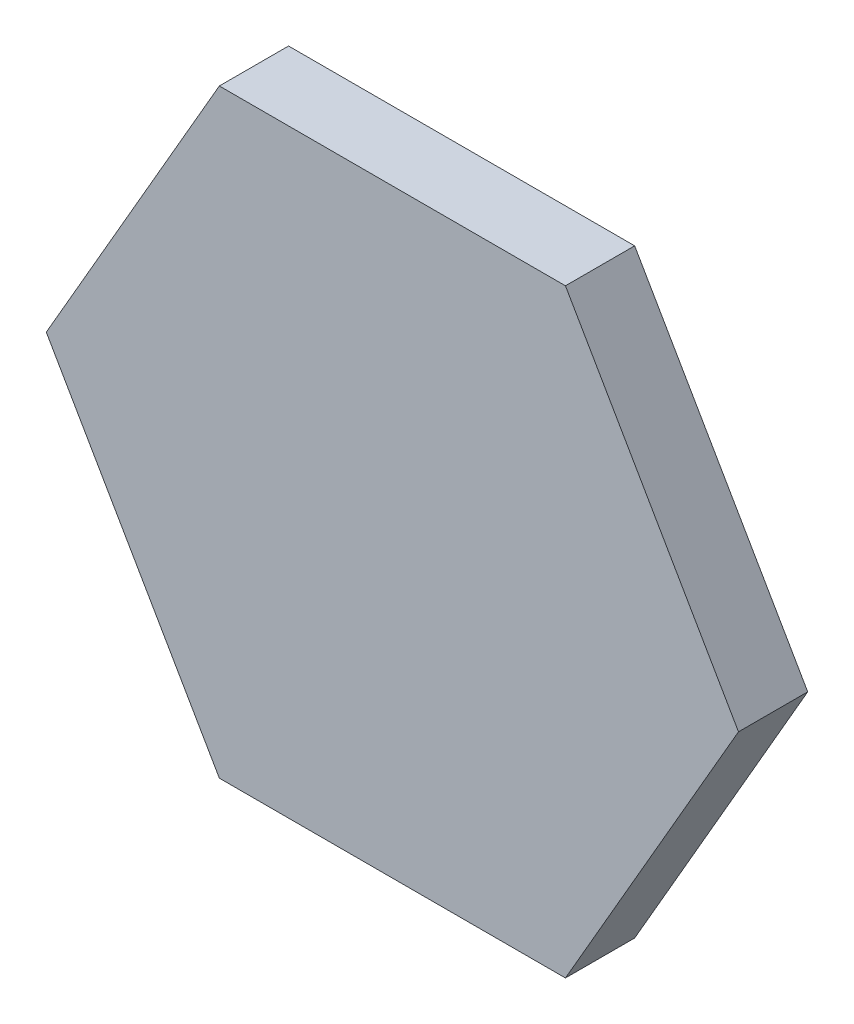
from build123d import *

# Parameters (mm, degrees)
BOSS_EXTRUDE1_DEPTH = 15


with BuildPart() as part:
    # Sketch1 → Boss-Extrude1 (new body)
    with BuildSketch(Plane.XY):
        Polygon((37.5, -64.951905284), (75, 0), (37.5, 64.951905284), (-37.5, 64.951905284), (-75, 0), (-37.5, -64.951905284), align=None)
    extrude(amount=BOSS_EXTRUDE1_DEPTH)


solid = part.part
